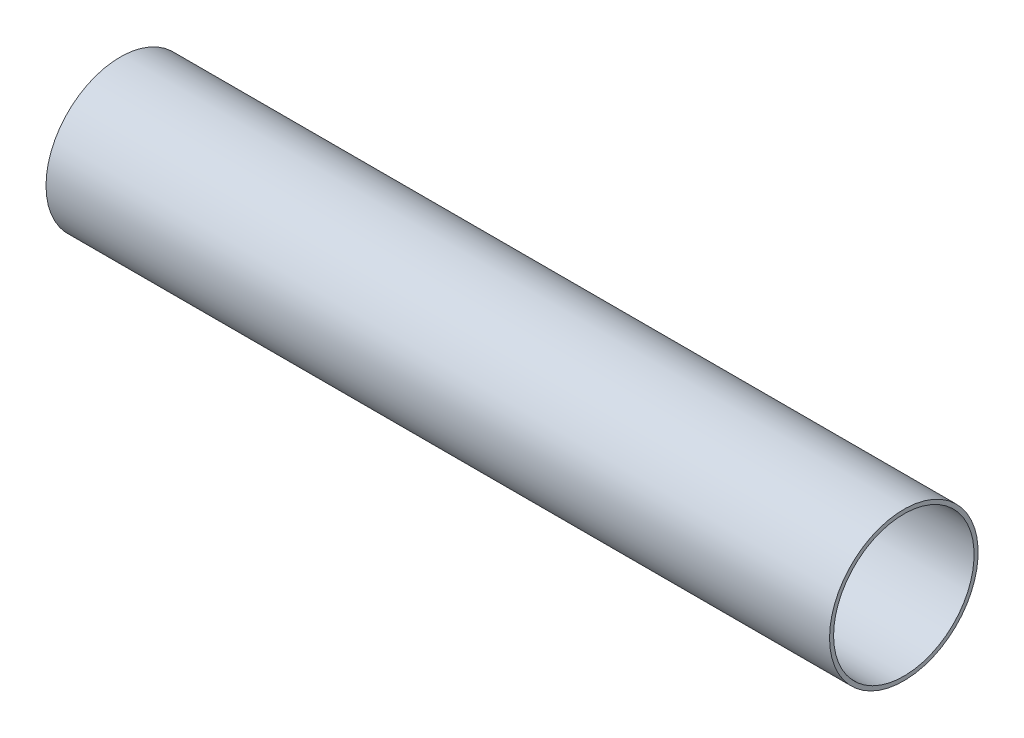
from build123d import *

# Parameters (mm, degrees)
SKETCH1_R           = 28.9052
SKETCH1_R_2         = 27.3304
BOSS_EXTRUDE1_DEPTH = 304.8


with BuildPart() as part:
    # Sketch1 → Boss-Extrude1 (new body)
    with BuildSketch(Plane(origin=(0, 0, 0), x_dir=(0, 0, -1), z_dir=(1, 0, 0))):
        with Locations(Location((0, 0, 0), (0, 0, 180))):
            Circle(SKETCH1_R)
        with Locations(Location((0, 0, 0), (0, 0, 180))):
            Circle(SKETCH1_R_2, mode=Mode.SUBTRACT)
    extrude(amount=BOSS_EXTRUDE1_DEPTH)


solid = part.part
